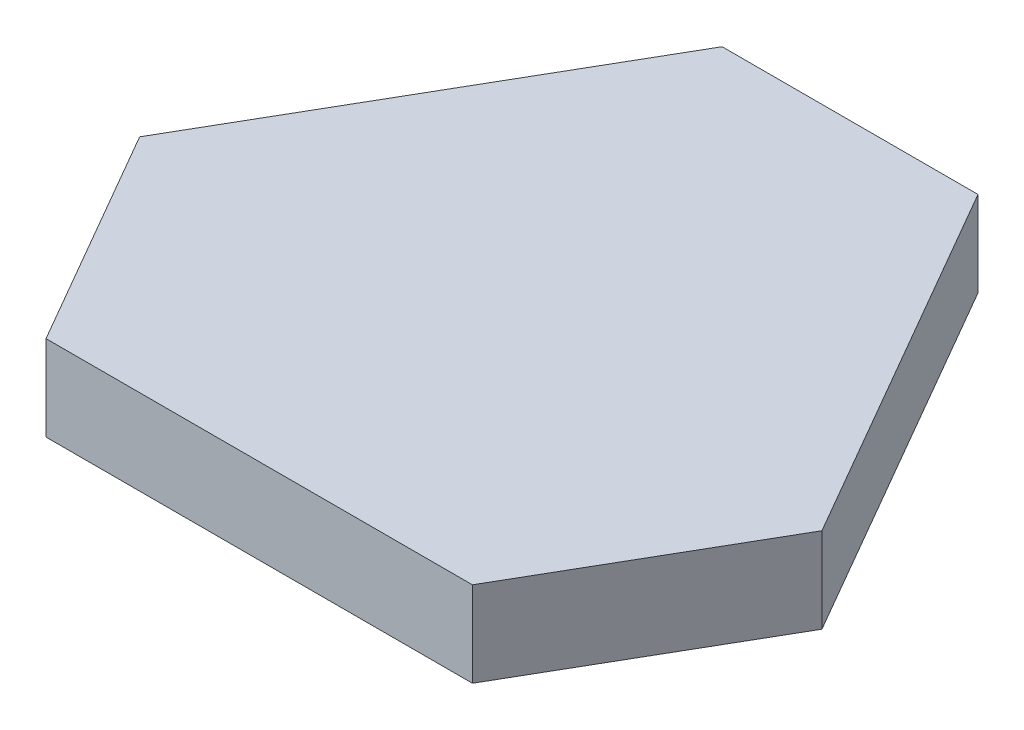
from build123d import *

# Parameters (mm, degrees)
EXTRUDE_1_DEPTH = 10


with BuildPart() as part:
    # 草图1 → 凸台-拉伸1 (new body)
    with BuildSketch(Plane(origin=(0, 0, 0), x_dir=(1, 0, 0), z_dir=(0, 1, 0))):
        Polygon((-15, 37.527767497), (15, 37.527767497), (40, -5.773502692), (25, -31.754264805), (-25, -31.754264805), (-40, -5.773502692), align=None)
    extrude(amount=EXTRUDE_1_DEPTH)


solid = part.part
